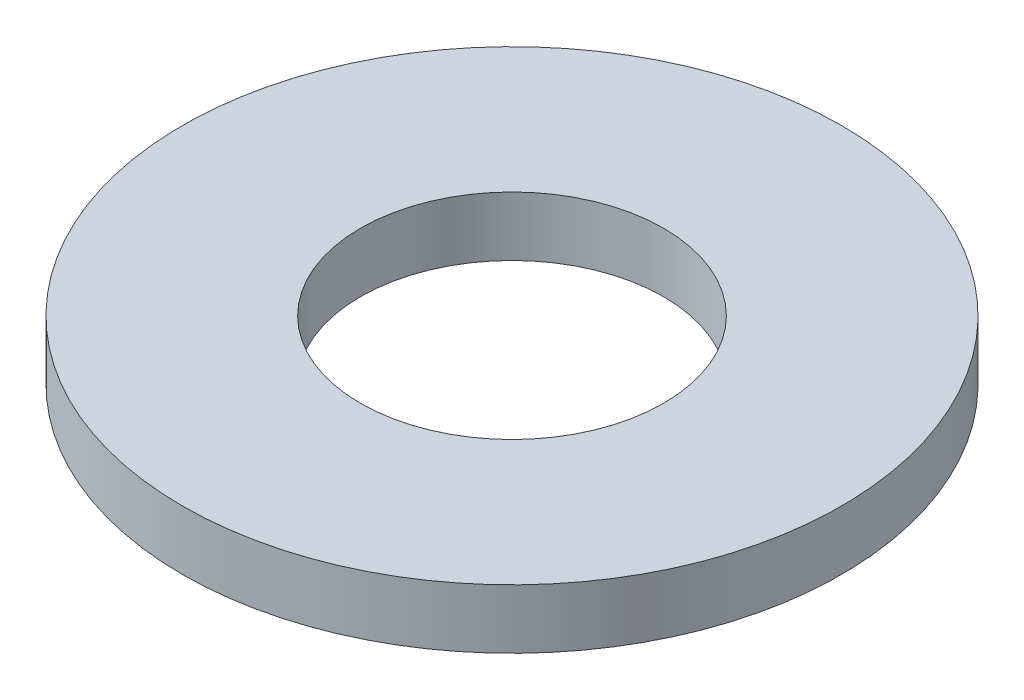
from build123d import *

# Parameters (mm, degrees)
SKETCH1_R           = 12.5
SKETCH1_R_2         = 5.75
BOSS_EXTRUDE1_DEPTH = 1.125


with BuildPart() as part:
    # Sketch1 → Boss-Extrude1 (new, symmetric)
    with BuildSketch(Plane(origin=(0, 0, 0), x_dir=(1, 0, 0), z_dir=(0, 1, 0))):
        with Locations(Location((0, 0, 0), (0, 0, 270))):
            Circle(SKETCH1_R)
        with Locations(Location((0, 0, 0), (0, 0, 270))):
            Circle(SKETCH1_R_2, mode=Mode.SUBTRACT)
    extrude(amount=BOSS_EXTRUDE1_DEPTH, both=True)


solid = part.part
